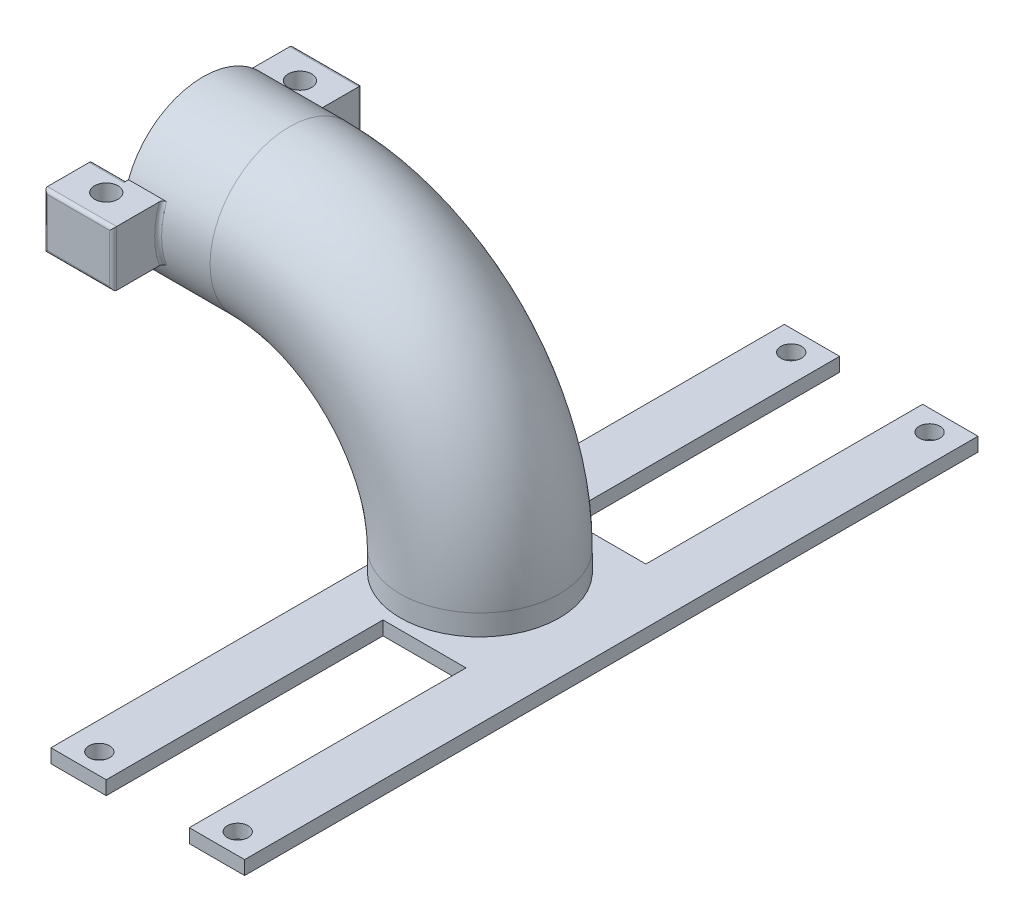
from build123d import *

# Parameters (mm, degrees)
SWEEP_1_PROFILE_R   = 11.5
SWEEP_1_PROFILE_R_2 = 9
EXTRUDE_1_DEPTH     = 5
SKETCH_31_R         = 1.7
CUT_EXTRUDE_1_DEPTH = 26
FILLET_1_R          = 0.5
SKETCH_32_R         = 11.5
SKETCH_32_R_2       = 9
EXTRUDE_2_DEPTH     = 5
EXTRUDE_START       = -2
SKETCH_33_R         = 1.5
EXTRUDE_3_DEPTH     = 2
SKETCH_34_W         = 12
SKETCH_34_H         = 40
CUT_EXTRUDE_2_DEPTH = 2
SKETCH_35_R         = 10.8
SKETCH_35_R_2       = 9
EXTRUDE_4_DEPTH     = 1


with BuildPart() as part:
    # 扫描-薄件1: sweep along a path in 草图1
    with BuildLine(Plane.XY) as sweep_1_path:
        Line((-40, 27.5), (-27.5, 27.5))
        ThreePointArc((-27.5, 27.5), (-8.054563517, 19.445436483), (0, 0))
    # 扫描-薄件1 profile (on start of the path) → 扫描-薄件1 (sweep)
    with BuildSketch(Plane(origin=(-40, 27.5, 0), x_dir=(0, 1, 0), z_dir=(1, 0, 0))):
        Circle(SWEEP_1_PROFILE_R)
        Circle(SWEEP_1_PROFILE_R_2, mode=Mode.SUBTRACT)
    sweep(path=sweep_1_path.line)

    # 草图30 → 凸台-拉伸1 (add, symmetric)
    with BuildSketch(Plane.ZY.offset(40)):
        with BuildLine():
            ThreePointArc((-10.781929326, 23.5), (-11.5, 27.5), (-10.781929326, 31.5))
            Line((-10.781929326, 31.5), (-18, 31.5))
            Line((-18, 31.5), (-18, 23.5))
            Line((-18, 23.5), (-10.781929326, 23.5))
        make_face()
        with BuildLine():
            Line((18, 31.5), (10.781929326, 31.5))
            ThreePointArc((10.781929326, 31.5), (11.319058867, 29.531971056), (11.5, 27.5))
            ThreePointArc((11.5, 27.5), (11.319058867, 25.468028944), (10.781929326, 23.5))
            Line((10.781929326, 23.5), (18, 23.5))
            Line((18, 23.5), (18, 31.5))
        make_face()
    extrude(amount=EXTRUDE_1_DEPTH, both=True)

    # 草图31 → 切除-拉伸1 (cut)
    with BuildSketch(Plane(origin=(0, 31.5, 0), x_dir=(1, 0, 0), z_dir=(0, 1, 0))):
        with Locations(Location((-40, 14, 0), (0, 0, 180))):
            Circle(SKETCH_31_R)
        with Locations(Location((-40, -14, 0), (0, 0, 180))):
            Circle(SKETCH_31_R)
    extrude(amount=-CUT_EXTRUDE_1_DEPTH, mode=Mode.SUBTRACT)

    # 圆角1
    fillet_1_edges = [part.edges().sort_by_distance(p)[0] for p in [
        (-35, 27.5, -18),
        (-40, 31.5, -18),
        (-40, 23.5, -18),
        (-42.5, 23.5, -10.781929326),
        (-45, 27.5, -11.5),
        (-42.5, 31.5, -10.781929326),
        (-45, 27.5, -18),
        (-35, 27.5, -11.5),
        (-42.5, 31.5, 10.781929326),
        (-45, 27.5, 11.5),
        (-42.5, 23.5, 10.781929326),
        (-45, 27.5, 18),
        (-40, 23.5, 18),
        (-40, 31.5, 18),
        (-35, 27.5, 11.5),
        (-35, 27.5, 18),
    ]]
    fillet(fillet_1_edges, radius=FILLET_1_R)

    # 草图32 → 凸台-拉伸2 (add)
    with BuildSketch(Plane.XZ):
        Circle(SKETCH_32_R)
        Circle(SKETCH_32_R_2, mode=Mode.SUBTRACT)
    extrude(amount=EXTRUDE_2_DEPTH)

    # 草图33 → 凸台-拉伸3 (add)
    with BuildSketch(Plane.XZ.offset(5).offset(EXTRUDE_START)):
        with BuildLine():
            Line((-9, -7.158910532), (-9, -53))
            Line((-9, -53), (19, -53))
            Line((19, -53), (19, 53))
            Line((19, 53), (-9, 53))
            Line((-9, 53), (-9, 7.158910532))
            ThreePointArc((-9, 7.158910532), (11.5, 0), (-9, -7.158910532))
        make_face()
        with Locations((-5, 50)):
            Circle(SKETCH_33_R, mode=Mode.SUBTRACT)
        with Locations((15, 50)):
            Circle(SKETCH_33_R, mode=Mode.SUBTRACT)
        with Locations((-5, -50)):
            Circle(SKETCH_33_R, mode=Mode.SUBTRACT)
        with Locations((15, -50)):
            Circle(SKETCH_33_R, mode=Mode.SUBTRACT)
    extrude(amount=EXTRUDE_3_DEPTH)

    # 草图34 → 切除-拉伸2 (cut)
    with BuildSketch(Plane.XZ.offset(5)):
        with Locations((5, 33)):
            Rectangle(SKETCH_34_W, SKETCH_34_H)
        with Locations((5, -33)):
            Rectangle(SKETCH_34_W, SKETCH_34_H)
    extrude(amount=-CUT_EXTRUDE_2_DEPTH, mode=Mode.SUBTRACT)

    # 草图35 → 凸台-拉伸4 (add)
    with BuildSketch(Plane.XZ.offset(5)):
        Circle(SKETCH_35_R)
        Circle(SKETCH_35_R_2, mode=Mode.SUBTRACT)
    extrude(amount=EXTRUDE_4_DEPTH)


solid = part.part
